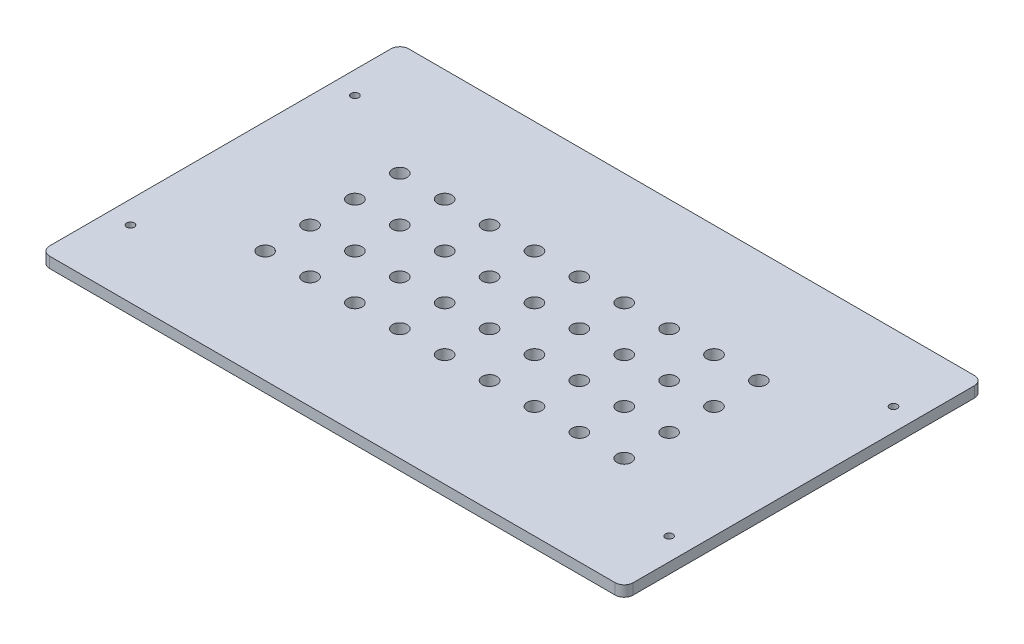
from build123d import *

# Parameters (mm, degrees)
SKETCH1_W                  = 650
SKETCH1_H                  = 400
BOSS_EXTRUDE1_DEPTH        = 12
FILLET1_R                  = 10
SKETCH31_R                 = 8.15
CUT_EXTRUDE3_DEPTH         = 764.311207831
LPATTERN1_COUNT            = 9
LPATTERN1_PITCH            = 50
LPATTERN2_COUNT            = 4
LPATTERN2_PITCH            = 50
LPATTERN2_COPY_1_SKETCH_R  = 8.15
LPATTERN2_COPY_1_DEPTH     = 764.311207831
LPATTERN2_COPY_2_SKETCH_R  = 8.15
LPATTERN2_COPY_2_DEPTH     = 764.311207831
LPATTERN2_COPY_3_SKETCH_R  = 8.15
LPATTERN2_COPY_3_DEPTH     = 764.311207831
LPATTERN2_COPY_4_SKETCH_R  = 8.15
LPATTERN2_COPY_4_DEPTH     = 764.311207831
LPATTERN2_COPY_5_SKETCH_R  = 8.15
LPATTERN2_COPY_5_DEPTH     = 764.311207831
LPATTERN2_COPY_6_SKETCH_R  = 8.15
LPATTERN2_COPY_6_DEPTH     = 764.311207831
LPATTERN2_COPY_7_SKETCH_R  = 8.15
LPATTERN2_COPY_7_DEPTH     = 764.311207831
LPATTERN2_COPY_8_SKETCH_R  = 8.15
LPATTERN2_COPY_8_DEPTH     = 764.311207831
LPATTERN2_COPY_9_SKETCH_R  = 8.15
LPATTERN2_COPY_9_DEPTH     = 764.311207831
LPATTERN2_COPY_10_SKETCH_R = 8.15
LPATTERN2_COPY_10_DEPTH    = 764.311207831
LPATTERN2_COPY_11_SKETCH_R = 8.15
LPATTERN2_COPY_11_DEPTH    = 764.311207831
LPATTERN2_COPY_12_SKETCH_R = 8.15
LPATTERN2_COPY_12_DEPTH    = 764.311207831
LPATTERN2_COPY_13_SKETCH_R = 8.15
LPATTERN2_COPY_13_DEPTH    = 764.311207831
LPATTERN2_COPY_14_SKETCH_R = 8.15
LPATTERN2_COPY_14_DEPTH    = 764.311207831
LPATTERN2_COPY_15_SKETCH_R = 8.15
LPATTERN2_COPY_15_DEPTH    = 764.311207831
LPATTERN2_COPY_16_SKETCH_R = 8.15
LPATTERN2_COPY_16_DEPTH    = 764.311207831
LPATTERN2_COPY_17_SKETCH_R = 8.15
LPATTERN2_COPY_17_DEPTH    = 764.311207831
LPATTERN2_COPY_18_SKETCH_R = 8.15
LPATTERN2_COPY_18_DEPTH    = 764.311207831
LPATTERN2_COPY_19_SKETCH_R = 8.15
LPATTERN2_COPY_19_DEPTH    = 764.311207831
LPATTERN2_COPY_20_SKETCH_R = 8.15
LPATTERN2_COPY_20_DEPTH    = 764.311207831
LPATTERN2_COPY_21_SKETCH_R = 8.15
LPATTERN2_COPY_21_DEPTH    = 764.311207831
LPATTERN2_COPY_22_SKETCH_R = 8.15
LPATTERN2_COPY_22_DEPTH    = 764.311207831
LPATTERN2_COPY_23_SKETCH_R = 8.15
LPATTERN2_COPY_23_DEPTH    = 764.311207831
LPATTERN2_COPY_24_SKETCH_R = 8.15
LPATTERN2_COPY_24_DEPTH    = 764.311207831
M8_CLEARANCE_HOLE2_D       = 8.4
LPATTERN3_COUNT            = 2
LPATTERN3_PITCH            = 250
LPATTERN3_COUNT_DIR2       = 2
LPATTERN3_PITCH_DIR2       = 600


with BuildPart() as part:
    # Sketch1 → Boss-Extrude1 (new body)
    with BuildSketch(Plane(origin=(0, 0, 0), x_dir=(1, 0, 0), z_dir=(0, 1, 0))):
        with Locations((325, -200)):
            Rectangle(SKETCH1_W, SKETCH1_H)
    extrude(amount=BOSS_EXTRUDE1_DEPTH)

    # Fillet1
    fillet1_edges = [part.edges().sort_by_distance(p)[0] for p in [
        (0, 6, 0),
        (650, 6, 0),
        (650, 6, 400),
        (0, 6, 400),
    ]]
    fillet(fillet1_edges, radius=FILLET1_R)

    # Sketch31 → Cut-Extrude3 (cut, through all)
    with BuildSketch(Plane(origin=(0, 12, 0), x_dir=(1, 0, 0), z_dir=(0, 1, 0))):
        with Locations(Location((125, -275, 0), (0, 0, 270))):
            Circle(SKETCH31_R)
    cut_extrude3 = extrude(amount=-CUT_EXTRUDE3_DEPTH, mode=Mode.SUBTRACT)

    # LPattern1: Cut-Extrude3 ×9
    with Locations(*[(i * LPATTERN1_PITCH, 0, 0) for i in range(1, LPATTERN1_COUNT)]):
        add(cut_extrude3, mode=Mode.SUBTRACT)

    # LPattern2: Cut-Extrude3 ×4
    with Locations(*[(0, 0, -i * LPATTERN2_PITCH) for i in range(1, LPATTERN2_COUNT)]):
        add(cut_extrude3, mode=Mode.SUBTRACT)

    # LPattern2 copy 1 sketch → LPattern2 copy 1 (cut, through all)
    with BuildSketch(Plane(origin=(50, 12, -50), x_dir=(1, 0, 0), z_dir=(0, 1, 0))):
        with Locations(Location((125, -275, 0), (0, 0, 270))):
            Circle(LPATTERN2_COPY_1_SKETCH_R)
    extrude(amount=-LPATTERN2_COPY_1_DEPTH, mode=Mode.SUBTRACT)

    # LPattern2 copy 2 sketch → LPattern2 copy 2 (cut, through all)
    with BuildSketch(Plane(origin=(50, 12, -100), x_dir=(1, 0, 0), z_dir=(0, 1, 0))):
        with Locations(Location((125, -275, 0), (0, 0, 270))):
            Circle(LPATTERN2_COPY_2_SKETCH_R)
    extrude(amount=-LPATTERN2_COPY_2_DEPTH, mode=Mode.SUBTRACT)

    # LPattern2 copy 3 sketch → LPattern2 copy 3 (cut, through all)
    with BuildSketch(Plane(origin=(50, 12, -150), x_dir=(1, 0, 0), z_dir=(0, 1, 0))):
        with Locations(Location((125, -275, 0), (0, 0, 270))):
            Circle(LPATTERN2_COPY_3_SKETCH_R)
    extrude(amount=-LPATTERN2_COPY_3_DEPTH, mode=Mode.SUBTRACT)

    # LPattern2 copy 4 sketch → LPattern2 copy 4 (cut, through all)
    with BuildSketch(Plane(origin=(100, 12, -50), x_dir=(1, 0, 0), z_dir=(0, 1, 0))):
        with Locations(Location((125, -275, 0), (0, 0, 270))):
            Circle(LPATTERN2_COPY_4_SKETCH_R)
    extrude(amount=-LPATTERN2_COPY_4_DEPTH, mode=Mode.SUBTRACT)

    # LPattern2 copy 5 sketch → LPattern2 copy 5 (cut, through all)
    with BuildSketch(Plane(origin=(100, 12, -100), x_dir=(1, 0, 0), z_dir=(0, 1, 0))):
        with Locations(Location((125, -275, 0), (0, 0, 270))):
            Circle(LPATTERN2_COPY_5_SKETCH_R)
    extrude(amount=-LPATTERN2_COPY_5_DEPTH, mode=Mode.SUBTRACT)

    # LPattern2 copy 6 sketch → LPattern2 copy 6 (cut, through all)
    with BuildSketch(Plane(origin=(100, 12, -150), x_dir=(1, 0, 0), z_dir=(0, 1, 0))):
        with Locations(Location((125, -275, 0), (0, 0, 270))):
            Circle(LPATTERN2_COPY_6_SKETCH_R)
    extrude(amount=-LPATTERN2_COPY_6_DEPTH, mode=Mode.SUBTRACT)

    # LPattern2 copy 7 sketch → LPattern2 copy 7 (cut, through all)
    with BuildSketch(Plane(origin=(150, 12, -50), x_dir=(1, 0, 0), z_dir=(0, 1, 0))):
        with Locations(Location((125, -275, 0), (0, 0, 270))):
            Circle(LPATTERN2_COPY_7_SKETCH_R)
    extrude(amount=-LPATTERN2_COPY_7_DEPTH, mode=Mode.SUBTRACT)

    # LPattern2 copy 8 sketch → LPattern2 copy 8 (cut, through all)
    with BuildSketch(Plane(origin=(150, 12, -100), x_dir=(1, 0, 0), z_dir=(0, 1, 0))):
        with Locations(Location((125, -275, 0), (0, 0, 270))):
            Circle(LPATTERN2_COPY_8_SKETCH_R)
    extrude(amount=-LPATTERN2_COPY_8_DEPTH, mode=Mode.SUBTRACT)

    # LPattern2 copy 9 sketch → LPattern2 copy 9 (cut, through all)
    with BuildSketch(Plane(origin=(150, 12, -150), x_dir=(1, 0, 0), z_dir=(0, 1, 0))):
        with Locations(Location((125, -275, 0), (0, 0, 270))):
            Circle(LPATTERN2_COPY_9_SKETCH_R)
    extrude(amount=-LPATTERN2_COPY_9_DEPTH, mode=Mode.SUBTRACT)

    # LPattern2 copy 10 sketch → LPattern2 copy 10 (cut, through all)
    with BuildSketch(Plane(origin=(200, 12, -50), x_dir=(1, 0, 0), z_dir=(0, 1, 0))):
        with Locations(Location((125, -275, 0), (0, 0, 270))):
            Circle(LPATTERN2_COPY_10_SKETCH_R)
    extrude(amount=-LPATTERN2_COPY_10_DEPTH, mode=Mode.SUBTRACT)

    # LPattern2 copy 11 sketch → LPattern2 copy 11 (cut, through all)
    with BuildSketch(Plane(origin=(200, 12, -100), x_dir=(1, 0, 0), z_dir=(0, 1, 0))):
        with Locations(Location((125, -275, 0), (0, 0, 270))):
            Circle(LPATTERN2_COPY_11_SKETCH_R)
    extrude(amount=-LPATTERN2_COPY_11_DEPTH, mode=Mode.SUBTRACT)

    # LPattern2 copy 12 sketch → LPattern2 copy 12 (cut, through all)
    with BuildSketch(Plane(origin=(200, 12, -150), x_dir=(1, 0, 0), z_dir=(0, 1, 0))):
        with Locations(Location((125, -275, 0), (0, 0, 270))):
            Circle(LPATTERN2_COPY_12_SKETCH_R)
    extrude(amount=-LPATTERN2_COPY_12_DEPTH, mode=Mode.SUBTRACT)

    # LPattern2 copy 13 sketch → LPattern2 copy 13 (cut, through all)
    with BuildSketch(Plane(origin=(250, 12, -50), x_dir=(1, 0, 0), z_dir=(0, 1, 0))):
        with Locations(Location((125, -275, 0), (0, 0, 270))):
            Circle(LPATTERN2_COPY_13_SKETCH_R)
    extrude(amount=-LPATTERN2_COPY_13_DEPTH, mode=Mode.SUBTRACT)

    # LPattern2 copy 14 sketch → LPattern2 copy 14 (cut, through all)
    with BuildSketch(Plane(origin=(250, 12, -100), x_dir=(1, 0, 0), z_dir=(0, 1, 0))):
        with Locations(Location((125, -275, 0), (0, 0, 270))):
            Circle(LPATTERN2_COPY_14_SKETCH_R)
    extrude(amount=-LPATTERN2_COPY_14_DEPTH, mode=Mode.SUBTRACT)

    # LPattern2 copy 15 sketch → LPattern2 copy 15 (cut, through all)
    with BuildSketch(Plane(origin=(250, 12, -150), x_dir=(1, 0, 0), z_dir=(0, 1, 0))):
        with Locations(Location((125, -275, 0), (0, 0, 270))):
            Circle(LPATTERN2_COPY_15_SKETCH_R)
    extrude(amount=-LPATTERN2_COPY_15_DEPTH, mode=Mode.SUBTRACT)

    # LPattern2 copy 16 sketch → LPattern2 copy 16 (cut, through all)
    with BuildSketch(Plane(origin=(300, 12, -50), x_dir=(1, 0, 0), z_dir=(0, 1, 0))):
        with Locations(Location((125, -275, 0), (0, 0, 270))):
            Circle(LPATTERN2_COPY_16_SKETCH_R)
    extrude(amount=-LPATTERN2_COPY_16_DEPTH, mode=Mode.SUBTRACT)

    # LPattern2 copy 17 sketch → LPattern2 copy 17 (cut, through all)
    with BuildSketch(Plane(origin=(300, 12, -100), x_dir=(1, 0, 0), z_dir=(0, 1, 0))):
        with Locations(Location((125, -275, 0), (0, 0, 270))):
            Circle(LPATTERN2_COPY_17_SKETCH_R)
    extrude(amount=-LPATTERN2_COPY_17_DEPTH, mode=Mode.SUBTRACT)

    # LPattern2 copy 18 sketch → LPattern2 copy 18 (cut, through all)
    with BuildSketch(Plane(origin=(300, 12, -150), x_dir=(1, 0, 0), z_dir=(0, 1, 0))):
        with Locations(Location((125, -275, 0), (0, 0, 270))):
            Circle(LPATTERN2_COPY_18_SKETCH_R)
    extrude(amount=-LPATTERN2_COPY_18_DEPTH, mode=Mode.SUBTRACT)

    # LPattern2 copy 19 sketch → LPattern2 copy 19 (cut, through all)
    with BuildSketch(Plane(origin=(350, 12, -50), x_dir=(1, 0, 0), z_dir=(0, 1, 0))):
        with Locations(Location((125, -275, 0), (0, 0, 270))):
            Circle(LPATTERN2_COPY_19_SKETCH_R)
    extrude(amount=-LPATTERN2_COPY_19_DEPTH, mode=Mode.SUBTRACT)

    # LPattern2 copy 20 sketch → LPattern2 copy 20 (cut, through all)
    with BuildSketch(Plane(origin=(350, 12, -100), x_dir=(1, 0, 0), z_dir=(0, 1, 0))):
        with Locations(Location((125, -275, 0), (0, 0, 270))):
            Circle(LPATTERN2_COPY_20_SKETCH_R)
    extrude(amount=-LPATTERN2_COPY_20_DEPTH, mode=Mode.SUBTRACT)

    # LPattern2 copy 21 sketch → LPattern2 copy 21 (cut, through all)
    with BuildSketch(Plane(origin=(350, 12, -150), x_dir=(1, 0, 0), z_dir=(0, 1, 0))):
        with Locations(Location((125, -275, 0), (0, 0, 270))):
            Circle(LPATTERN2_COPY_21_SKETCH_R)
    extrude(amount=-LPATTERN2_COPY_21_DEPTH, mode=Mode.SUBTRACT)

    # LPattern2 copy 22 sketch → LPattern2 copy 22 (cut, through all)
    with BuildSketch(Plane(origin=(400, 12, -50), x_dir=(1, 0, 0), z_dir=(0, 1, 0))):
        with Locations(Location((125, -275, 0), (0, 0, 270))):
            Circle(LPATTERN2_COPY_22_SKETCH_R)
    extrude(amount=-LPATTERN2_COPY_22_DEPTH, mode=Mode.SUBTRACT)

    # LPattern2 copy 23 sketch → LPattern2 copy 23 (cut, through all)
    with BuildSketch(Plane(origin=(400, 12, -100), x_dir=(1, 0, 0), z_dir=(0, 1, 0))):
        with Locations(Location((125, -275, 0), (0, 0, 270))):
            Circle(LPATTERN2_COPY_23_SKETCH_R)
    extrude(amount=-LPATTERN2_COPY_23_DEPTH, mode=Mode.SUBTRACT)

    # LPattern2 copy 24 sketch → LPattern2 copy 24 (cut, through all)
    with BuildSketch(Plane(origin=(400, 12, -150), x_dir=(1, 0, 0), z_dir=(0, 1, 0))):
        with Locations(Location((125, -275, 0), (0, 0, 270))):
            Circle(LPATTERN2_COPY_24_SKETCH_R)
    extrude(amount=-LPATTERN2_COPY_24_DEPTH, mode=Mode.SUBTRACT)

    # M8 Clearance Hole2 (through all)
    with Locations(Plane(origin=(0, 0, 0), x_dir=(-1, 0, 0), z_dir=(0, -1, 0))):
        with Locations((-25, -75)):
            m8_clearance_hole2 = Hole(M8_CLEARANCE_HOLE2_D / 2)

    # LPattern3: M8 Clearance Hole2 2 × 2
    with Locations(*[(j * LPATTERN3_PITCH_DIR2, 0, i * LPATTERN3_PITCH) for i in range(LPATTERN3_COUNT) for j in range(LPATTERN3_COUNT_DIR2) if (i, j) != (0, 0)]):
        add(m8_clearance_hole2, mode=Mode.SUBTRACT)


solid = part.part
